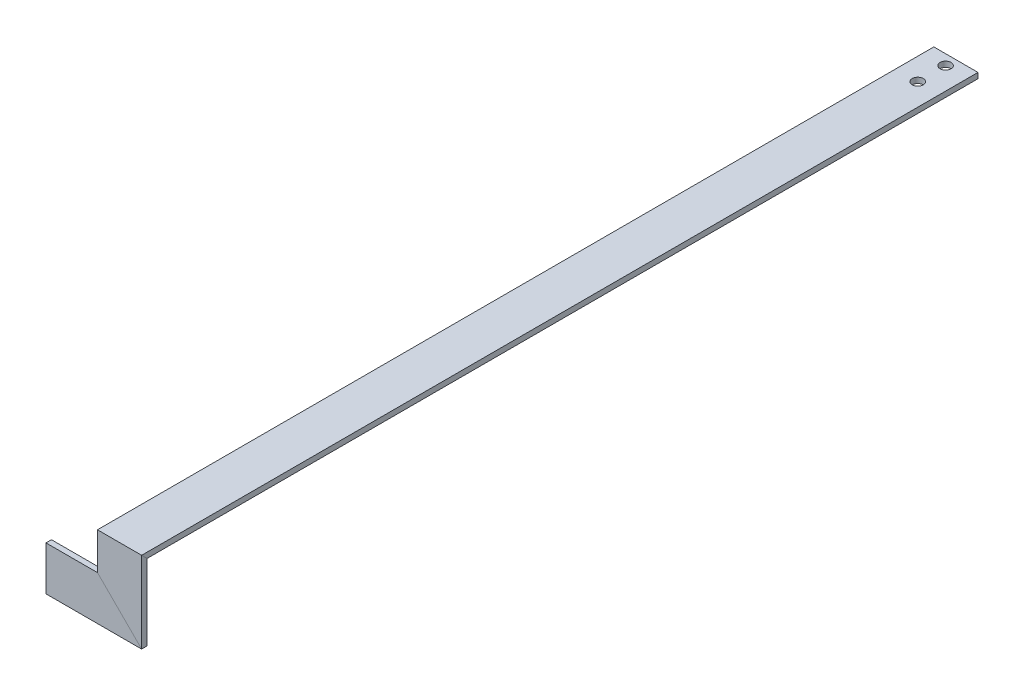
from build123d import *

# Parameters (mm, degrees)
CROQUIS1_W            = 50.8
CROQUIS1_H            = 6.31
CROQUIS2_R            = 6.35
CORTAR_EXTRUIR1_DEPTH = 6.31


with BuildPart() as part:
    # Barrer1: sweep along a curve in space
    with BuildLine() as barrer1_path:
        Line((0, 0, 0), (0, 0, 958.84))
        Line((0, 0, 958.84), (0, -64.9, 958.84))
        Line((0, -64.9, 958.84), (-84.6, -64.9, 958.84))
    # Croquis1 → Barrer1 (sweep)
    with BuildSketch(Plane.XY):
        Rectangle(CROQUIS1_W, CROQUIS1_H)
    sweep(path=barrer1_path.line, transition=Transition.RIGHT)

    # Croquis2 → Cortar-Extruir1 (cut)
    with BuildSketch(Plane(origin=(0, 3.155, 0), x_dir=(1, 0, 0), z_dir=(0, 1, 0))):
        with Locations(Location((0, -43.892204666, 0), (0, 0, 270))):
            Circle(CROQUIS2_R)
        with Locations(Location((0, -11.892204666, 0), (0, 0, 270))):
            Circle(CROQUIS2_R)
    extrude(amount=-CORTAR_EXTRUIR1_DEPTH, mode=Mode.SUBTRACT)


solid = part.part
